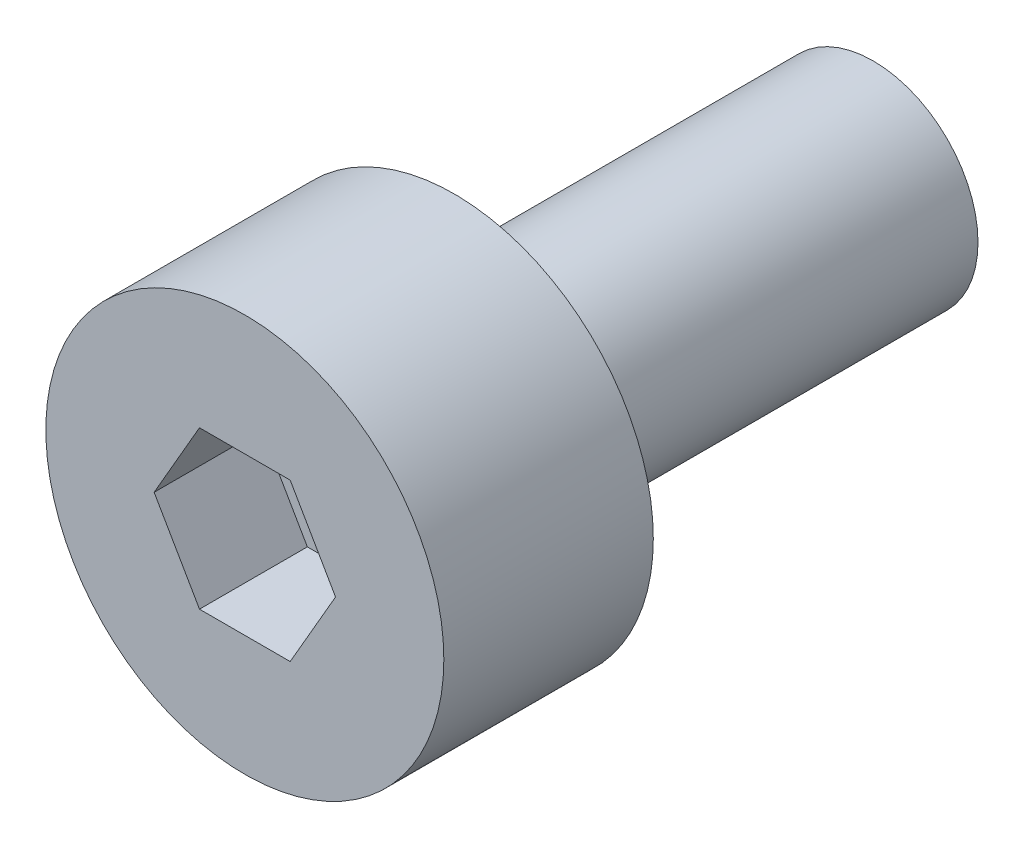
from build123d import *

# Parameters (mm, degrees)
ISO4762_HEAD_SKETCH_R                   = 1.9
ISO4762_HEAD_DEPTH                      = 2
THREAD_MAJOR_DIAMETER_ENVELOPE_START    = -4
THREAD_MAJOR_DIAMETER_ENVELOPE_SKETCH_R = 1
THREAD_MAJOR_DIAMETER_ENVELOPE_DEPTH    = 4
HEX_SOCKET_START                        = 0.97
HEX_SOCKET_DEPTH                        = 1.03


with BuildPart() as part:
    # ISO4762_head_Sketch → ISO4762_head (new body)
    with BuildSketch(Plane.XY):
        Circle(ISO4762_HEAD_SKETCH_R)
    extrude(amount=ISO4762_HEAD_DEPTH)

    # Thread_major_diameter_envelope_Sketch → Thread_major_diameter_envelope (add)
    with BuildSketch(Plane.XY.offset(THREAD_MAJOR_DIAMETER_ENVELOPE_START)):
        Circle(THREAD_MAJOR_DIAMETER_ENVELOPE_SKETCH_R)
    extrude(amount=THREAD_MAJOR_DIAMETER_ENVELOPE_DEPTH)

    # Hex_socket_Sketch → Hex_socket (cut)
    with BuildSketch(Plane.XY.offset(HEX_SOCKET_START)):
        Polygon((0.866025404, 0), (0.433012702, 0.75), (-0.433012702, 0.75), (-0.866025404, 0), (-0.433012702, -0.75), (0.433012702, -0.75), align=None)
    extrude(amount=HEX_SOCKET_DEPTH, mode=Mode.SUBTRACT)


solid = part.part
